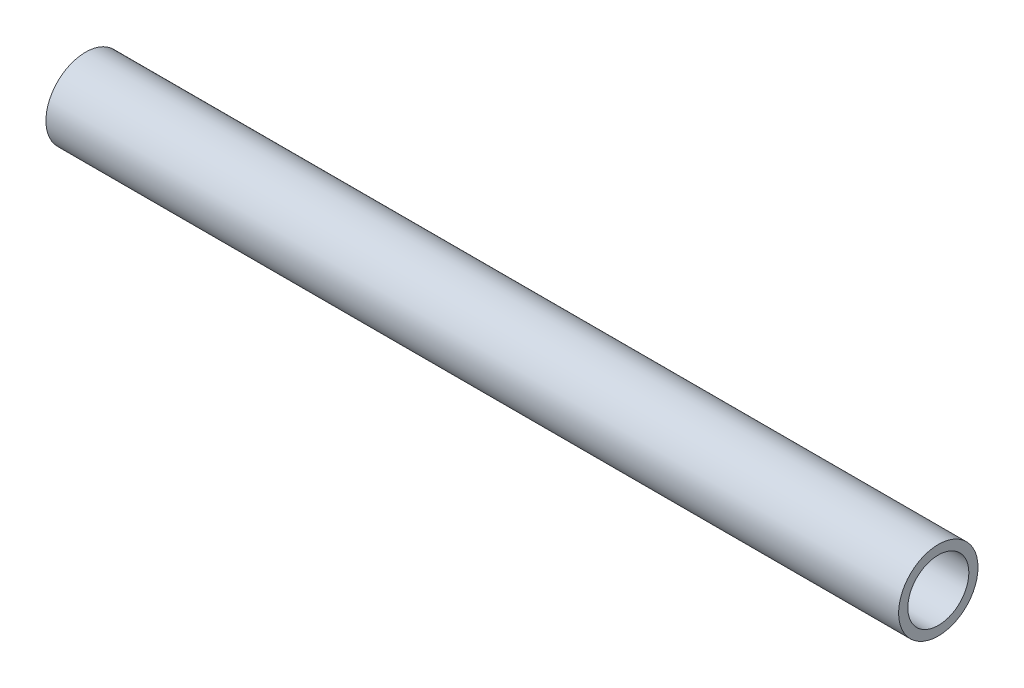
from build123d import *

# Parameters (mm, degrees)
SKETCH1_R           = 6.5
SKETCH1_R_2         = 5
BOSS_EXTRUDE1_DEPTH = 139.7


with BuildPart() as part:
    # Sketch1 → Boss-Extrude1 (new body)
    with BuildSketch(Plane(origin=(0, 0, 0), x_dir=(0, 0, -1), z_dir=(1, 0, 0))):
        Circle(SKETCH1_R)
        Circle(SKETCH1_R_2, mode=Mode.SUBTRACT)
    extrude(amount=BOSS_EXTRUDE1_DEPTH)


solid = part.part
